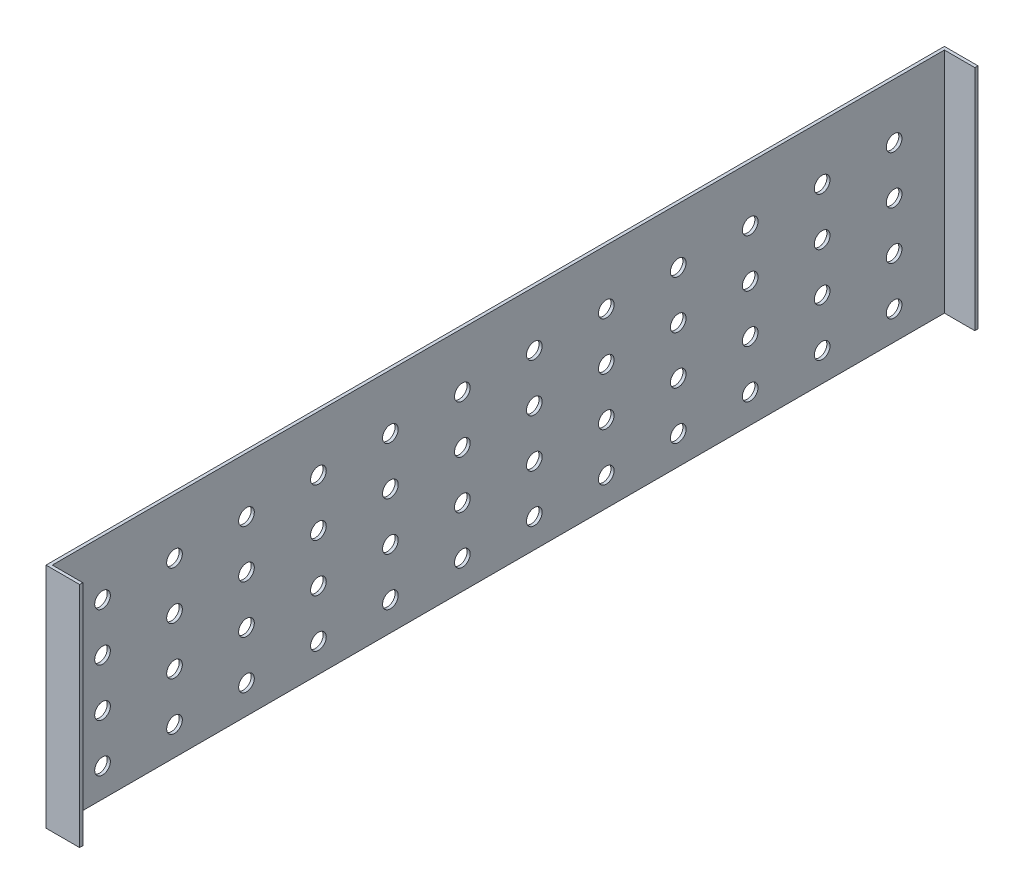
from build123d import *

# Parameters (mm, degrees)
SKETCH1_W           = 374.525504892
SKETCH1_H           = 95
SKETCH1_R           = 3.2639
BOSS_EXTRUDE1_DEPTH = 1.31064
SKETCH2_W           = 1.31064
SKETCH2_H           = 95
BOSS_EXTRUDE2_DEPTH = 12.7


with BuildPart() as part:
    # Sketch1 → Boss-Extrude1 (new body)
    with BuildSketch(Plane(origin=(0, 0, 0), x_dir=(0, 0, -1), z_dir=(1, 0, 0))):
        with Locations((0, 5.5)):
            Rectangle(SKETCH1_W, SKETCH1_H)
        with Locations((-165, -30)):
            Circle(SKETCH1_R, mode=Mode.SUBTRACT)
        with Locations((-135, -30)):
            Circle(SKETCH1_R, mode=Mode.SUBTRACT)
        with Locations((-105, -30)):
            Circle(SKETCH1_R, mode=Mode.SUBTRACT)
        with Locations((-75, -30)):
            Circle(SKETCH1_R, mode=Mode.SUBTRACT)
        with Locations((-45, -30)):
            Circle(SKETCH1_R, mode=Mode.SUBTRACT)
        with Locations((-15, -30)):
            Circle(SKETCH1_R, mode=Mode.SUBTRACT)
        with Locations((15, -30)):
            Circle(SKETCH1_R, mode=Mode.SUBTRACT)
        with Locations((45, -30)):
            Circle(SKETCH1_R, mode=Mode.SUBTRACT)
        with Locations((75, -30)):
            Circle(SKETCH1_R, mode=Mode.SUBTRACT)
        with Locations((105, -30)):
            Circle(SKETCH1_R, mode=Mode.SUBTRACT)
        with Locations((135, -30)):
            Circle(SKETCH1_R, mode=Mode.SUBTRACT)
        with Locations((165, -30)):
            Circle(SKETCH1_R, mode=Mode.SUBTRACT)
        with Locations((-135, -10)):
            Circle(SKETCH1_R, mode=Mode.SUBTRACT)
        with Locations((-105, -10)):
            Circle(SKETCH1_R, mode=Mode.SUBTRACT)
        with Locations((-75, -10)):
            Circle(SKETCH1_R, mode=Mode.SUBTRACT)
        with Locations((-45, -10)):
            Circle(SKETCH1_R, mode=Mode.SUBTRACT)
        with Locations((-15, -10)):
            Circle(SKETCH1_R, mode=Mode.SUBTRACT)
        with Locations((15, -10)):
            Circle(SKETCH1_R, mode=Mode.SUBTRACT)
        with Locations((45, -10)):
            Circle(SKETCH1_R, mode=Mode.SUBTRACT)
        with Locations((75, -10)):
            Circle(SKETCH1_R, mode=Mode.SUBTRACT)
        with Locations((105, -10)):
            Circle(SKETCH1_R, mode=Mode.SUBTRACT)
        with Locations((135, -10)):
            Circle(SKETCH1_R, mode=Mode.SUBTRACT)
        with Locations((165, -10)):
            Circle(SKETCH1_R, mode=Mode.SUBTRACT)
        with Locations((-135, 10)):
            Circle(SKETCH1_R, mode=Mode.SUBTRACT)
        with Locations((-105, 10)):
            Circle(SKETCH1_R, mode=Mode.SUBTRACT)
        with Locations((-75, 10)):
            Circle(SKETCH1_R, mode=Mode.SUBTRACT)
        with Locations((-45, 10)):
            Circle(SKETCH1_R, mode=Mode.SUBTRACT)
        with Locations((-15, 10)):
            Circle(SKETCH1_R, mode=Mode.SUBTRACT)
        with Locations((15, 10)):
            Circle(SKETCH1_R, mode=Mode.SUBTRACT)
        with Locations((45, 10)):
            Circle(SKETCH1_R, mode=Mode.SUBTRACT)
        with Locations((75, 10)):
            Circle(SKETCH1_R, mode=Mode.SUBTRACT)
        with Locations((105, 10)):
            Circle(SKETCH1_R, mode=Mode.SUBTRACT)
        with Locations((135, 10)):
            Circle(SKETCH1_R, mode=Mode.SUBTRACT)
        with Locations((165, 10)):
            Circle(SKETCH1_R, mode=Mode.SUBTRACT)
        with Locations((-135, 30)):
            Circle(SKETCH1_R, mode=Mode.SUBTRACT)
        with Locations((-105, 30)):
            Circle(SKETCH1_R, mode=Mode.SUBTRACT)
        with Locations((-75, 30)):
            Circle(SKETCH1_R, mode=Mode.SUBTRACT)
        with Locations((-45, 30)):
            Circle(SKETCH1_R, mode=Mode.SUBTRACT)
        with Locations((-15, 30)):
            Circle(SKETCH1_R, mode=Mode.SUBTRACT)
        with Locations((15, 30)):
            Circle(SKETCH1_R, mode=Mode.SUBTRACT)
        with Locations((45, 30)):
            Circle(SKETCH1_R, mode=Mode.SUBTRACT)
        with Locations((75, 30)):
            Circle(SKETCH1_R, mode=Mode.SUBTRACT)
        with Locations((105, 30)):
            Circle(SKETCH1_R, mode=Mode.SUBTRACT)
        with Locations((135, 30)):
            Circle(SKETCH1_R, mode=Mode.SUBTRACT)
        with Locations((165, 30)):
            Circle(SKETCH1_R, mode=Mode.SUBTRACT)
        with Locations((-165, -10)):
            Circle(SKETCH1_R, mode=Mode.SUBTRACT)
        with Locations((-165, 10)):
            Circle(SKETCH1_R, mode=Mode.SUBTRACT)
        with Locations((-165, 30)):
            Circle(SKETCH1_R, mode=Mode.SUBTRACT)
    extrude(amount=BOSS_EXTRUDE1_DEPTH)

    # Sketch2 → Boss-Extrude2 (add)
    with BuildSketch(Plane(origin=(1.31064, 0, 0), x_dir=(0, 0, -1), z_dir=(1, 0, 0))):
        with Locations((-186.607432446, 5.5)):
            Rectangle(SKETCH2_W, SKETCH2_H)
        with Locations((186.607432446, 5.5)):
            Rectangle(SKETCH2_W, SKETCH2_H)
    extrude(amount=BOSS_EXTRUDE2_DEPTH)


solid = part.part
